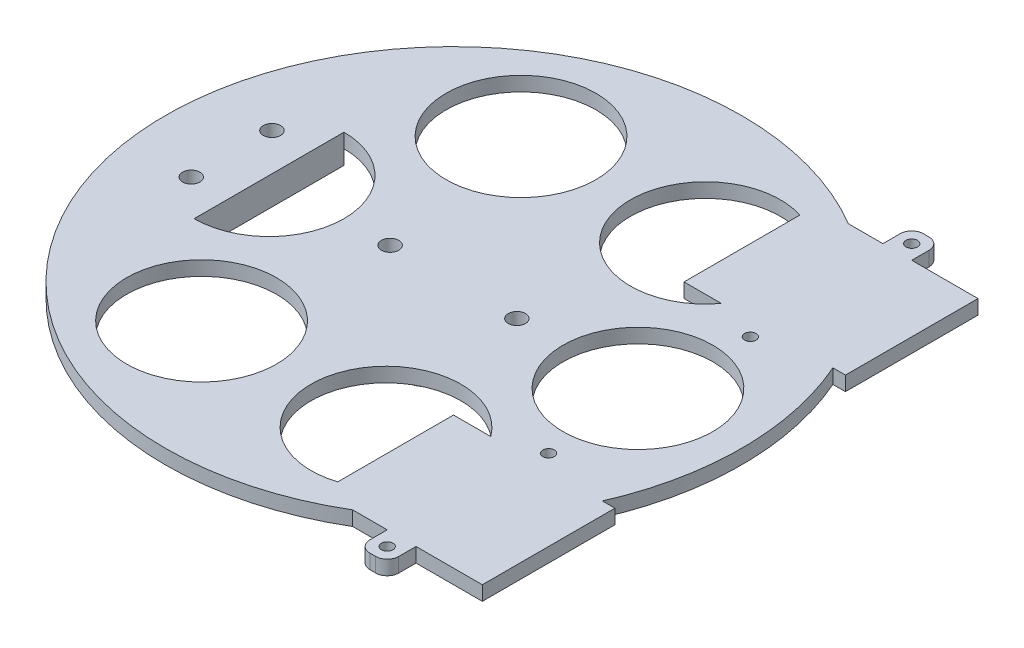
from build123d import *

# Parameters (mm, degrees)
SKETCH_1_R          = 50
EXTRUDE_1_DEPTH     = 2.5
SKETCH_2_R          = 15
EXTRUDE_2_DEPTH     = 3
SKETCH_3_R          = 1.5
CUT_EXTRUDE_1_DEPTH = 71.924255371
SKETCH_5_R          = 13
CUT_EXTRUDE_3_DEPTH = 71.774289117
SKETCH_6_W          = 13
SKETCH_6_H          = 26
EXTRUDE_3_DEPTH     = 2.5
SKETCH_8_R          = 1.5
CUT_EXTRUDE_4_DEPTH = 71.887234394
EXTRUDE_4_DEPTH     = 2.5
SKETCH_11_R         = 1
CUT_EXTRUDE_5_DEPTH = 71.774289117
FILLET_1_R          = 2


with BuildPart() as part:
    # 草图1 → 凸台-拉伸1 (new body)
    with BuildSketch(Plane(origin=(0, 0, 0), x_dir=(1, 0, 0), z_dir=(0, 1, 0))):
        with Locations(Location((0, 0, 0), (0, 0, 270))):
            Circle(SKETCH_1_R)
    extrude(amount=EXTRUDE_1_DEPTH)

    # 草图2 → 凸台-拉伸2 (add)
    with BuildSketch(Plane(origin=(0, 0, 0), x_dir=(-1, 0, 0), z_dir=(0, -1, 0))):
        with Locations(Location((0, 0, 0), (0, 0, 270))):
            Circle(SKETCH_2_R)
    extrude(amount=EXTRUDE_2_DEPTH)

    # 草图3 → 切除-拉伸1 (cut, through all)
    with BuildSketch(Plane(origin=(0, -3, 0), x_dir=(-1, 0, 0), z_dir=(0, -1, 0))):
        with Locations(Location((11, 0, 0), (0, 0, 90))):
            Circle(SKETCH_3_R)
        with Locations(Location((-11, 0, 0), (0, 0, 90))):
            Circle(SKETCH_3_R)
    extrude(amount=-CUT_EXTRUDE_1_DEPTH, mode=Mode.SUBTRACT)

    # 草图5 → 切除-拉伸3 (cut, through all)
    with BuildSketch(Plane(origin=(0, 0, 0), x_dir=(-1, 0, 0), z_dir=(0, -1, 0))):
        with Locations(Location((32, 0, 0), (0, 0, 90))):
            Circle(SKETCH_5_R)
        with Locations(Location((16, -27.712812921, 0), (0, 0, 90))):
            Circle(SKETCH_5_R)
        with Locations(Location((-16, -27.712812921, 0), (0, 0, 90))):
            Circle(SKETCH_5_R)
        with Locations(Location((-32, 0, 0), (0, 0, 90))):
            Circle(SKETCH_5_R)
        with Locations(Location((-16, 27.712812921, 0), (0, 0, 90))):
            Circle(SKETCH_5_R)
        with Locations(Location((16, 27.712812921, 0), (0, 0, 90))):
            Circle(SKETCH_5_R)
    extrude(amount=-CUT_EXTRUDE_3_DEPTH, mode=Mode.SUBTRACT)

    # 草图6 → 凸台-拉伸3 (add, symmetric)
    with BuildSketch(Plane(origin=(0, 0, 0), x_dir=(-1, 0, 0), z_dir=(0, -1, 0))):
        with Locations((38.5, 0)):
            Rectangle(SKETCH_6_W, SKETCH_6_H)
    extrude(amount=EXTRUDE_3_DEPTH, both=True)

    # 草图8 → 切除-拉伸4 (cut, through all)
    with BuildSketch(Plane(origin=(0, -2.5, 0), x_dir=(-1, 0, 0), z_dir=(0, -1, 0))):
        with Locations(Location((38.5, -7, 0), (0, 0, 90))):
            Circle(SKETCH_8_R)
        with Locations(Location((38.5, 7, 0), (0, 0, 90))):
            Circle(SKETCH_8_R)
    extrude(amount=-CUT_EXTRUDE_4_DEPTH, mode=Mode.SUBTRACT)

    # 草图9 → 凸台-拉伸4 (add)
    with BuildSketch(Plane(origin=(0, 0, 0), x_dir=(-1, 0, 0), z_dir=(0, -1, 0))):
        Polygon((-36.5, -43), (-48, -43), (-48, -20), (-20, -20), (-20, -43), (-31.5, -43), (-31.5, -48), (-36.5, -48), align=None)
        Polygon((-31.5, 43), (-31.5, 48), (-36.5, 48), (-36.5, 43), (-48, 43), (-48, 20), (-20, 20), (-20, 43), align=None)
    extrude(amount=-EXTRUDE_4_DEPTH)

    # 草图11 → 切除-拉伸5 (cut, through all)
    with BuildSketch(Plane(origin=(0, 0, 0), x_dir=(-1, 0, 0), z_dir=(0, -1, 0))):
        with Locations(Location((-34, -45.5, 0), (0, 0, 90))):
            Circle(SKETCH_11_R)
        with Locations(Location((-34, -17.5, 0), (0, 0, 90))):
            Circle(SKETCH_11_R)
        with Locations(Location((-34, 17.5, 0), (0, 0, 270))):
            Circle(SKETCH_11_R)
        with Locations(Location((-34, 45.5, 0), (0, 0, 270))):
            Circle(SKETCH_11_R)
    extrude(amount=-CUT_EXTRUDE_5_DEPTH, mode=Mode.SUBTRACT)

    # 圆角1
    fillet_1_edges = [part.edges().sort_by_distance(p)[0] for p in [
        (36.5, 1.25, -48),
        (31.5, 1.25, -48),
        (31.5, 1.25, 48),
        (36.5, 1.25, 48),
    ]]
    fillet(fillet_1_edges, radius=FILLET_1_R)


solid = part.part
